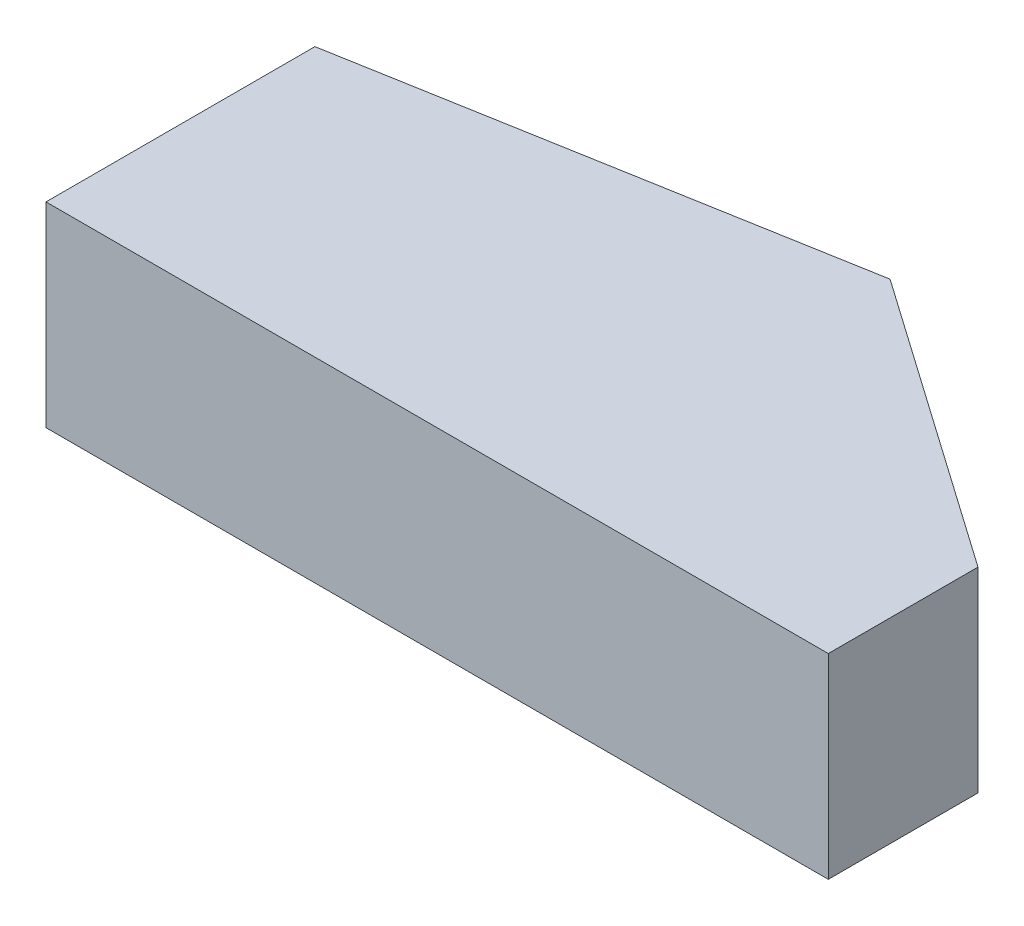
from build123d import *

# Parameters (mm, degrees)
SALIENTE_EXTRUIR1_DEPTH = 25.4


with BuildPart() as part:
    # Croquis2 → Saliente-Extruir1 (new body)
    with BuildSketch(Plane(origin=(0, 0, 0), x_dir=(1, 0, 0), z_dir=(0, 1, 0))):
        Polygon((0, 0), (101.6, 0), (101.6, 19.443856069), (63.5, 46.121763275), (0, 34.925), align=None)
    extrude(amount=SALIENTE_EXTRUIR1_DEPTH)


solid = part.part
